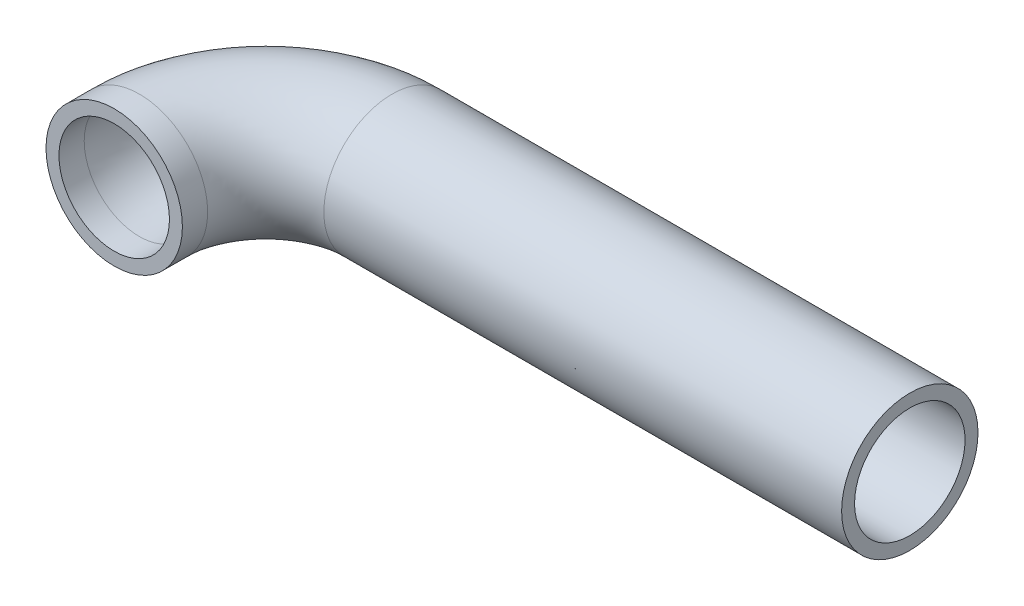
from build123d import *

# Parameters (mm, degrees)
SKETCH1_R   = 6.858
SKETCH1_R_2 = 5.55625


with BuildPart() as part:
    # Sweep1: sweep along a path in Sketch2
    with BuildLine(Plane(origin=(0, 0, 0), x_dir=(1, 0, 0), z_dir=(0, 1, 0))) as sweep1_path:
        Line((0, 0), (0, 2.54))
        ThreePointArc((0, 2.54), (3.719743879, 11.520256121), (12.7, 15.24))
        Line((12.7, 15.24), (64.77, 15.24))
    # Sketch1 → Sweep1 (sweep)
    with BuildSketch(Plane.XY):
        Circle(SKETCH1_R)
        Circle(SKETCH1_R_2, mode=Mode.SUBTRACT)
    sweep(path=sweep1_path.line)


solid = part.part
